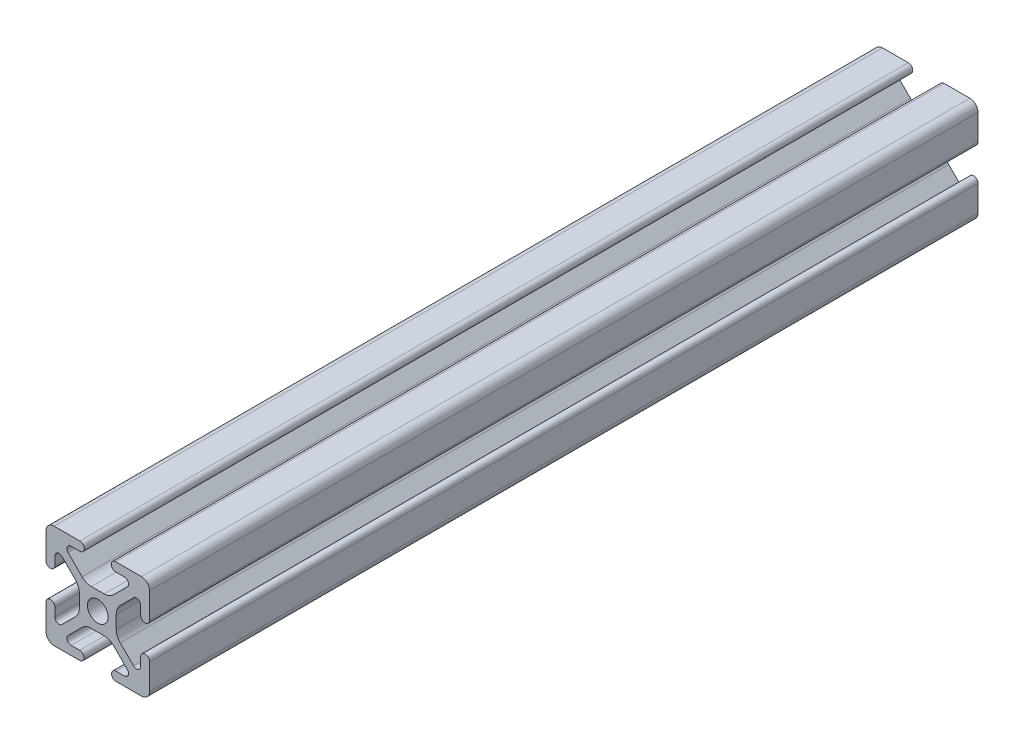
from build123d import *

# Parameters (mm, degrees)
SKETCH1_R           = 2.5
BOSS_EXTRUDE1_DEPTH = 200


with BuildPart() as part:
    # Sketch1 → Boss-Extrude1 (new body)
    with BuildSketch(Plane(origin=(0, 0, -25), x_dir=(-1, 0, 0), z_dir=(0, 0, -1))):
        with BuildLine():
            Line((12.5, 4.32), (12.5, 10.537068835))
            ThreePointArc((12.5, 10.537068835), (11.925070773, 11.925070773), (10.537068835, 12.5))
            Line((10.537068835, 12.5), (4.32, 12.5))
            ThreePointArc((4.32, 12.5), (3.25, 11.43), (4.32, 10.36))
            Line((4.32, 10.36), (6.42, 10.36))
            ThreePointArc((6.42, 10.36), (7.35325999, 9.736168088), (7.133653911, 8.635298598))
            Line((7.133653911, 8.635298598), (3.795290766, 5.301828272))
            ThreePointArc((3.795290766, 5.301828272), (2.76743922, 4.61585726), (1.555406707, 4.375))
            Line((1.555406707, 4.375), (-1.555406707, 4.375))
            ThreePointArc((-1.555406707, 4.375), (-2.76743922, 4.61585726), (-3.795290766, 5.301828272))
            Line((-3.795290766, 5.301828272), (-7.133653912, 8.635298598))
            ThreePointArc((-7.133653912, 8.635298598), (-7.35325999, 9.736168088), (-6.42, 10.36))
            Line((-6.42, 10.36), (-4.32, 10.36))
            ThreePointArc((-4.32, 10.36), (-3.25, 11.43), (-4.32, 12.5))
            Line((-4.32, 12.5), (-10.537068835, 12.5))
            ThreePointArc((-10.537068835, 12.5), (-11.925070773, 11.925070773), (-12.5, 10.537068835))
            Line((-12.5, 10.537068835), (-12.5, 4.32))
            ThreePointArc((-12.5, 4.32), (-11.43, 3.25), (-10.36, 4.32))
            Line((-10.36, 4.32), (-10.36, 6.396886949))
            ThreePointArc((-10.36, 6.396886949), (-9.736852394, 7.329863489), (-8.636346088, 7.111588351))
            Line((-8.636346088, 7.111588351), (-5.432204773, 3.912143135))
            ThreePointArc((-5.432204773, 3.912143135), (-4.708985779, 2.831057106), (-4.455, 1.555406707))
            Line((-4.455, 1.555406707), (-4.455, -1.555406707))
            ThreePointArc((-4.455, -1.555406707), (-4.708985779, -2.831057106), (-5.432204773, -3.912143135))
            Line((-5.432204773, -3.912143135), (-8.636346088, -7.111588351))
            ThreePointArc((-8.636346088, -7.111588351), (-9.736852394, -7.329863489), (-10.36, -6.396886949))
            Line((-10.36, -6.396886949), (-10.36, -4.32))
            ThreePointArc((-10.36, -4.32), (-11.43, -3.25), (-12.5, -4.32))
            Line((-12.5, -4.32), (-12.5, -10.537068835))
            ThreePointArc((-12.5, -10.537068835), (-11.925070773, -11.925070773), (-10.537068835, -12.5))
            Line((-10.537068835, -12.5), (-4.387856959, -12.5))
            ThreePointArc((-4.387856959, -12.5), (-3.317856959, -11.43), (-4.387856959, -10.36))
            Line((-4.387856959, -10.36), (-6.42, -10.36))
            ThreePointArc((-6.42, -10.36), (-7.35325999, -9.736168088), (-7.133653912, -8.635298598))
            Line((-7.133653912, -8.635298598), (-3.795290766, -5.301828272))
            ThreePointArc((-3.795290766, -5.301828272), (-2.76743922, -4.61585726), (-1.555406707, -4.375))
            Line((-1.555406707, -4.375), (1.555406707, -4.375))
            ThreePointArc((1.555406707, -4.375), (2.76743922, -4.61585726), (3.795290766, -5.301828272))
            Line((3.795290766, -5.301828272), (7.133653912, -8.635298598))
            ThreePointArc((7.133653912, -8.635298598), (7.35325999, -9.736168088), (6.42, -10.36))
            Line((6.42, -10.36), (4.387856959, -10.36))
            ThreePointArc((4.387856959, -10.36), (3.317856959, -11.43), (4.387856959, -12.5))
            Line((4.387856959, -12.5), (10.537068835, -12.5))
            ThreePointArc((10.537068835, -12.5), (11.925070773, -11.925070773), (12.5, -10.537068835))
            Line((12.5, -10.537068835), (12.5, -4.32))
            ThreePointArc((12.5, -4.32), (11.43, -3.25), (10.36, -4.32))
            Line((10.36, -4.32), (10.36, -6.396886949))
            ThreePointArc((10.36, -6.396886949), (9.736852394, -7.329863489), (8.636346088, -7.111588351))
            Line((8.636346088, -7.111588351), (5.432204773, -3.912143135))
            ThreePointArc((5.432204773, -3.912143135), (4.708985779, -2.831057106), (4.455, -1.555406707))
            Line((4.455, -1.555406707), (4.455, 1.555406707))
            ThreePointArc((4.455, 1.555406707), (4.708985779, 2.831057106), (5.432204773, 3.912143135))
            Line((5.432204773, 3.912143135), (8.636346088, 7.111588351))
            ThreePointArc((8.636346088, 7.111588351), (9.736852394, 7.329863489), (10.36, 6.396886949))
            Line((10.36, 6.396886949), (10.36, 4.32))
            ThreePointArc((10.36, 4.32), (11.43, 3.25), (12.5, 4.32))
        make_face()
        with Locations(Location((0, 0, 0), (0, 0, 180))):
            Circle(SKETCH1_R, mode=Mode.SUBTRACT)
    extrude(amount=-BOSS_EXTRUDE1_DEPTH)


solid = part.part
